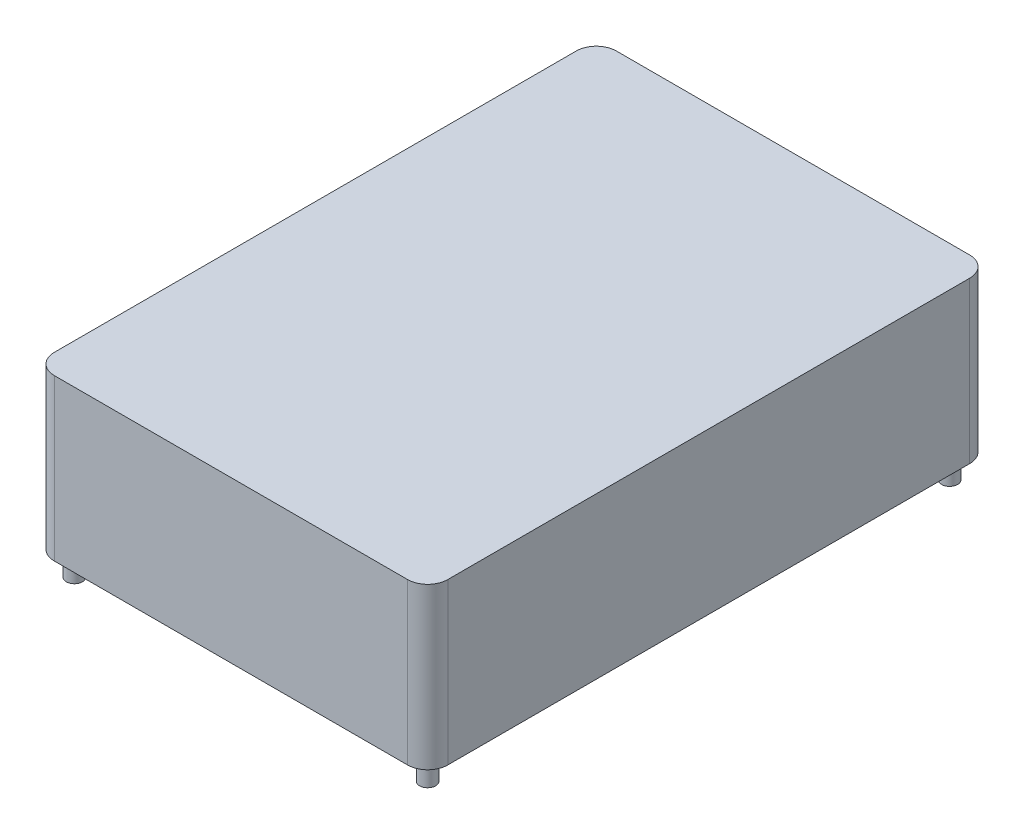
from build123d import *

# Parameters (mm, degrees)
SKETCH1_W           = 124.46
SKETCH1_H           = 177.8
BOSS_EXTRUDE1_DEPTH = 50.8
FILLET1_R           = 6.35
SKETCH3_R           = 2.54
BOSS_EXTRUDE2_DEPTH = 58.42


with BuildPart() as part:
    # Sketch1 → Boss-Extrude1 (new body)
    with BuildSketch(Plane(origin=(0, 0, 0), x_dir=(1, 0, 0), z_dir=(0, 1, 0))):
        Rectangle(SKETCH1_W, SKETCH1_H)
    extrude(amount=BOSS_EXTRUDE1_DEPTH)

    # Fillet1
    fillet1_edges = [part.edges().sort_by_distance(p)[0] for p in [
        (62.23, 25.4, 88.9),
        (-62.23, 25.4, 88.9),
        (-62.23, 25.4, -88.9),
        (62.23, 25.4, -88.9),
    ]]
    fillet(fillet1_edges, radius=FILLET1_R)

    # Sketch3 → Boss-Extrude2 (add)
    with BuildSketch(Plane(origin=(0, 50.8, 0), x_dir=(1, 0, 0), z_dir=(0, 1, 0))):
        with Locations(Location((-55.88, 82.55, 0), (0, 0, 270))):
            Circle(SKETCH3_R)
        with Locations(Location((55.88, 82.55, 0), (0, 0, 270))):
            Circle(SKETCH3_R)
        with Locations(Location((-55.88, -82.55, 0), (0, 0, 270))):
            Circle(SKETCH3_R)
        with Locations(Location((55.88, -82.55, 0), (0, 0, 270))):
            Circle(SKETCH3_R)
    extrude(amount=-BOSS_EXTRUDE2_DEPTH)


solid = part.part
